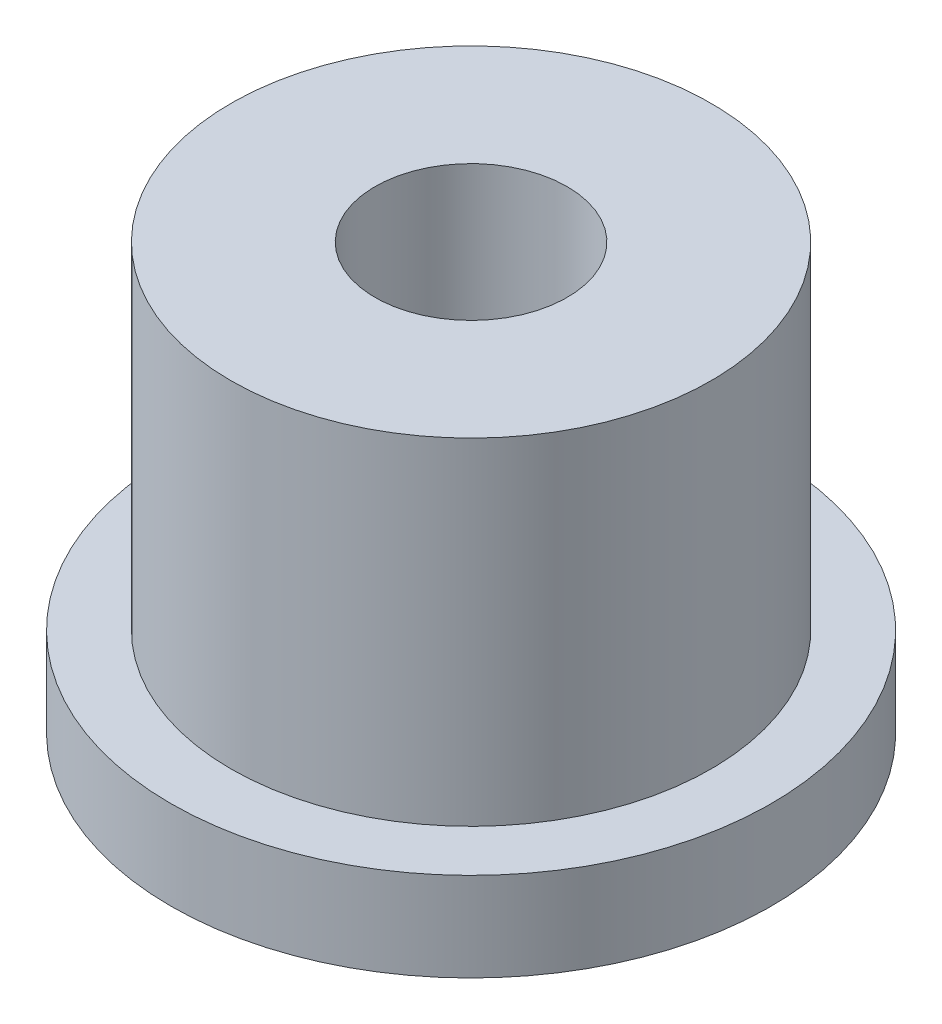
from build123d import *

# Parameters (mm, degrees)
SKETCH1_R           = 5
BOSS_EXTRUDE1_DEPTH = 1.48
SKETCH2_R           = 4
BOSS_EXTRUDE2_DEPTH = 5.6
SKETCH3_R           = 1.6
CUT_EXTRUDE1_DEPTH  = 11.006318004
SKETCH4_R           = 3
CUT_EXTRUDE2_DEPTH  = 2


with BuildPart() as part:
    # Sketch1 → Boss-Extrude1 (new body)
    with BuildSketch(Plane(origin=(0, 0, 0), x_dir=(1, 0, 0), z_dir=(0, 1, 0))):
        with Locations(Location((0, 0, 0), (0, 0, 270))):
            Circle(SKETCH1_R)
    extrude(amount=BOSS_EXTRUDE1_DEPTH)

    # Sketch2 → Boss-Extrude2 (add)
    with BuildSketch(Plane(origin=(0, 1.48, 0), x_dir=(1, 0, 0), z_dir=(0, 1, 0))):
        with Locations(Location((0, 0, 0), (0, 0, 270))):
            Circle(SKETCH2_R)
    extrude(amount=BOSS_EXTRUDE2_DEPTH)

    # Sketch3 → Cut-Extrude1 (cut, through all)
    with BuildSketch(Plane.XZ):
        with Locations(Location((0, 0, 0), (0, 0, 270))):
            Circle(SKETCH3_R)
    extrude(amount=-CUT_EXTRUDE1_DEPTH, mode=Mode.SUBTRACT)

    # Sketch4 → Cut-Extrude2 (cut)
    with BuildSketch(Plane.XZ):
        with Locations(Location((0, 0, 0), (0, 0, 270))):
            Circle(SKETCH4_R)
    extrude(amount=-CUT_EXTRUDE2_DEPTH, mode=Mode.SUBTRACT)


solid = part.part
